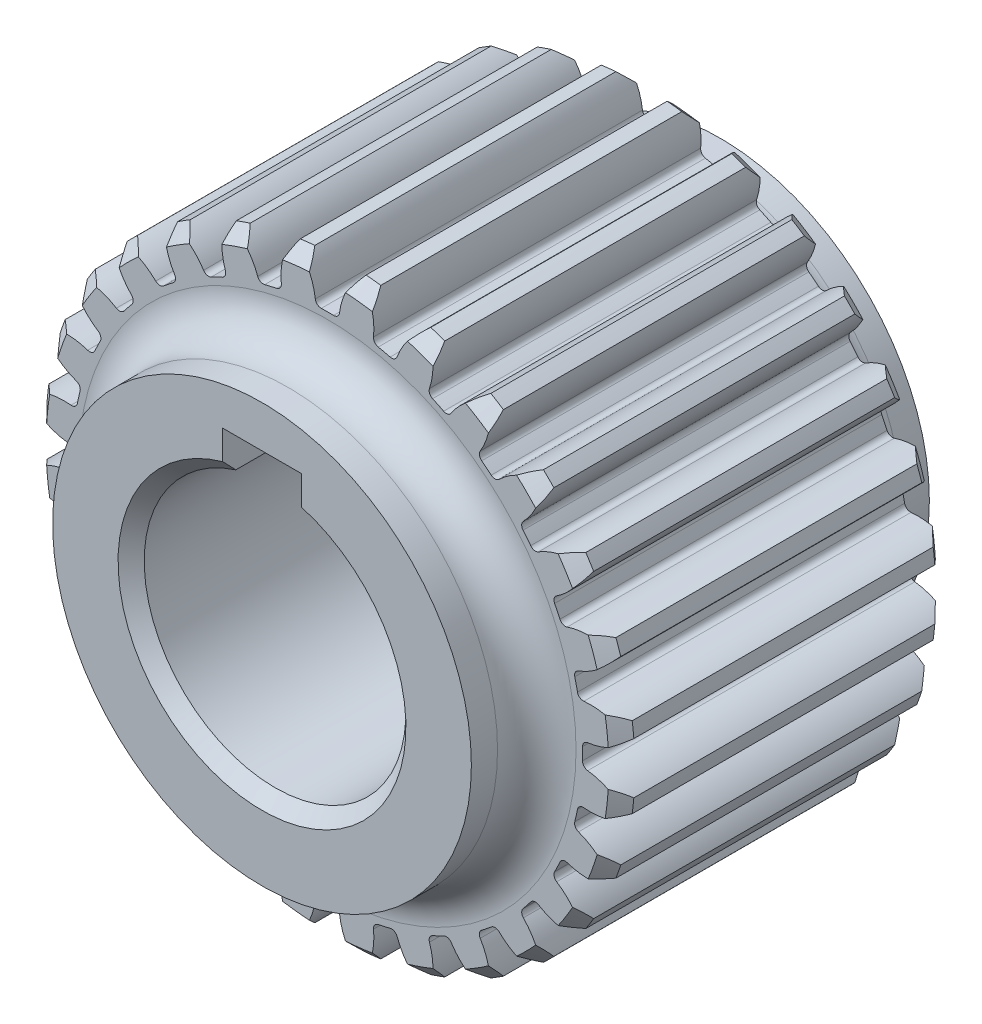
from build123d import *

# Parameters (mm, degrees)
SKETCH1_R                = 16
BOSS_EXTRUDE1_DEPTH      = 17.5
SKETCH1_3_R              = 22.5
SKETCH1_3_R_2            = 16
BOSS_EXTRUDE2_DEPTH      = 12.5
CHAMFER1_SIZE            = 1
FILLET1_R                = 3
CUT_EXTRUDE1_DEPTH       = 44.732139211
FILLET2_R                = 0.45
CIRPATTERN3_COUNT        = 28
FILLET2_OF_CIRPATTERN3_R = 0.45
CUT_EXTRUDE2_DEPTH       = 48.221079298
CUT_EXTRUDE2_DEPTH_BACK  = 48.221079298
CHAMFER2_SIZE            = 1


with BuildPart() as part:
    # Sketch1 → Boss-Extrude1 (new, symmetric)
    with BuildSketch(Plane.XY):
        Circle(SKETCH1_R)
    extrude(amount=BOSS_EXTRUDE1_DEPTH, both=True)

    # Sketch1<3> → Boss-Extrude2 (add, symmetric)
    with BuildSketch(Plane.XY):
        Circle(SKETCH1_3_R)
        Circle(SKETCH1_3_R_2, mode=Mode.SUBTRACT)
    extrude(amount=BOSS_EXTRUDE2_DEPTH, both=True)

    # Chamfer1
    chamfer1_edges = [part.edges().sort_by_distance(p)[0] for p in [
        (-22.5, 0, -12.5),
        (-22.5, 0, 12.5),
    ]]
    chamfer(chamfer1_edges, length=CHAMFER1_SIZE)

    # Fillet1
    fillet1_edges = [part.edges().sort_by_distance(p)[0] for p in [
        (-16, 0, -12.5),
        (-16, 0, 12.5),
    ]]
    fillet(fillet1_edges, radius=FILLET1_R)

    # Sketch3 → Cut-Extrude1 (cut, symmetric)
    with BuildSketch(Plane.XY.offset(12.5)):
        with BuildLine():
            ThreePointArc((1.958274615, 22.414619348), (0, 22.5), (-1.958274615, 22.414619348))
            ThreePointArc((-1.958274615, 22.414619348), (-1.199814846, 21.028802799), (-0.89004303, 19.479677189))
            ThreePointArc((-0.89004303, 19.479677189), (0, 19.5), (0.89004303, 19.479677189))
            ThreePointArc((0.89004303, 19.479677189), (1.199814846, 21.028802799), (1.958274615, 22.414619348))
        make_face()
    cut_extrude1 = extrude(amount=CUT_EXTRUDE1_DEPTH, both=True, mode=Mode.SUBTRACT)

    # Fillet2
    fillet2_edges = [part.edges().sort_by_distance(p)[0] for p in [
        (0.89004303, 19.479677189, 0),
        (-0.89004303, 19.479677189, 0),
    ]]
    fillet(fillet2_edges, radius=FILLET2_R)

    # CirPattern3: Cut-Extrude1 ×28 about axis
    cirpattern3_axis = Axis((0, 0, 12.5), (0, 0, -1))
    for i in range(1, CIRPATTERN3_COUNT):
        add(cut_extrude1.rotate(cirpattern3_axis, i * 360 / CIRPATTERN3_COUNT), mode=Mode.SUBTRACT)

    # Fillet2 of CirPattern3
    fillet2_of_cirpattern3_edges = [part.edges().sort_by_distance(p)[0] for p in [
        (5.202363755, 18.793227806, 0),
        (3.466908168, 19.189334219, 0),
        (9.253816237, 17.164407507, 0),
        (7.650014114, 17.936757902, 0),
        (12.841243733, 14.674892142, 0),
        (11.449516409, 15.784757648, 0),
        (15.784757648, 11.449516409, 0),
        (14.674892142, 12.841243733, 0),
        (17.936757902, 7.650014114, 0),
        (17.164407507, 9.253816237, 0),
        (19.189334219, 3.466908168, 0),
        (18.793227806, 5.202363755, 0),
        (19.479677189, -0.89004303, 0),
        (19.479677189, 0.89004303, 0),
        (18.793227806, -5.202363755, 0),
        (19.189334219, -3.466908168, 0),
        (17.164407507, -9.253816237, 0),
        (17.936757902, -7.650014114, 0),
        (14.674892142, -12.841243733, 0),
        (15.784757648, -11.449516409, 0),
        (11.449516409, -15.784757648, 0),
        (12.841243733, -14.674892142, 0),
        (7.650014114, -17.936757902, 0),
        (9.253816237, -17.164407507, 0),
        (3.466908168, -19.189334219, 0),
        (5.202363755, -18.793227806, 0),
        (-0.89004303, -19.479677189, 0),
        (0.89004303, -19.479677189, 0),
        (-5.202363755, -18.793227806, 0),
        (-3.466908168, -19.189334219, 0),
        (-9.253816237, -17.164407507, 0),
        (-7.650014114, -17.936757902, 0),
        (-12.841243733, -14.674892142, 0),
        (-11.449516409, -15.784757648, 0),
        (-15.784757648, -11.449516409, 0),
        (-14.674892142, -12.841243733, 0),
        (-17.936757902, -7.650014114, 0),
        (-17.164407507, -9.253816237, 0),
        (-19.189334219, -3.466908168, 0),
        (-18.793227806, -5.202363755, 0),
        (-19.479677189, 0.89004303, 0),
        (-19.479677189, -0.89004303, 0),
        (-18.793227806, 5.202363755, 0),
        (-19.189334219, 3.466908168, 0),
        (-17.164407507, 9.253816237, 0),
        (-17.936757902, 7.650014114, 0),
        (-14.674892142, 12.841243733, 0),
        (-15.784757648, 11.449516409, 0),
        (-11.449516409, 15.784757648, 0),
        (-12.841243733, 14.674892142, 0),
        (-7.650014114, 17.936757902, 0),
        (-9.253816237, 17.164407507, 0),
        (-3.466908168, 19.189334219, 0),
        (-5.202363755, 18.793227806, 0),
    ]]
    fillet(fillet2_of_cirpattern3_edges, radius=FILLET2_OF_CIRPATTERN3_R)

    # Sketch4 → Cut-Extrude2 (cut, two sides: drawn at the far end of the back side and taken through both)
    with BuildSketch(Plane.XY.offset(17.5).offset(-CUT_EXTRUDE2_DEPTH_BACK)):
        with BuildLine():
            Line((3, 12.8), (-3, 12.8))
            Line((-3, 12.8), (-3, 9.539392014))
            ThreePointArc((-3, 9.539392014), (0, -10), (3, 9.539392014))
            Line((3, 9.539392014), (3, 12.8))
        make_face()
    extrude(amount=CUT_EXTRUDE2_DEPTH + CUT_EXTRUDE2_DEPTH_BACK, mode=Mode.SUBTRACT)

    # Chamfer2
    chamfer2_edges = [part.edges().sort_by_distance(p)[0] for p in [
        (0, -10, 17.5),
        (0, -10, -17.5),
    ]]
    chamfer(chamfer2_edges, length=CHAMFER2_SIZE)


solid = part.part
